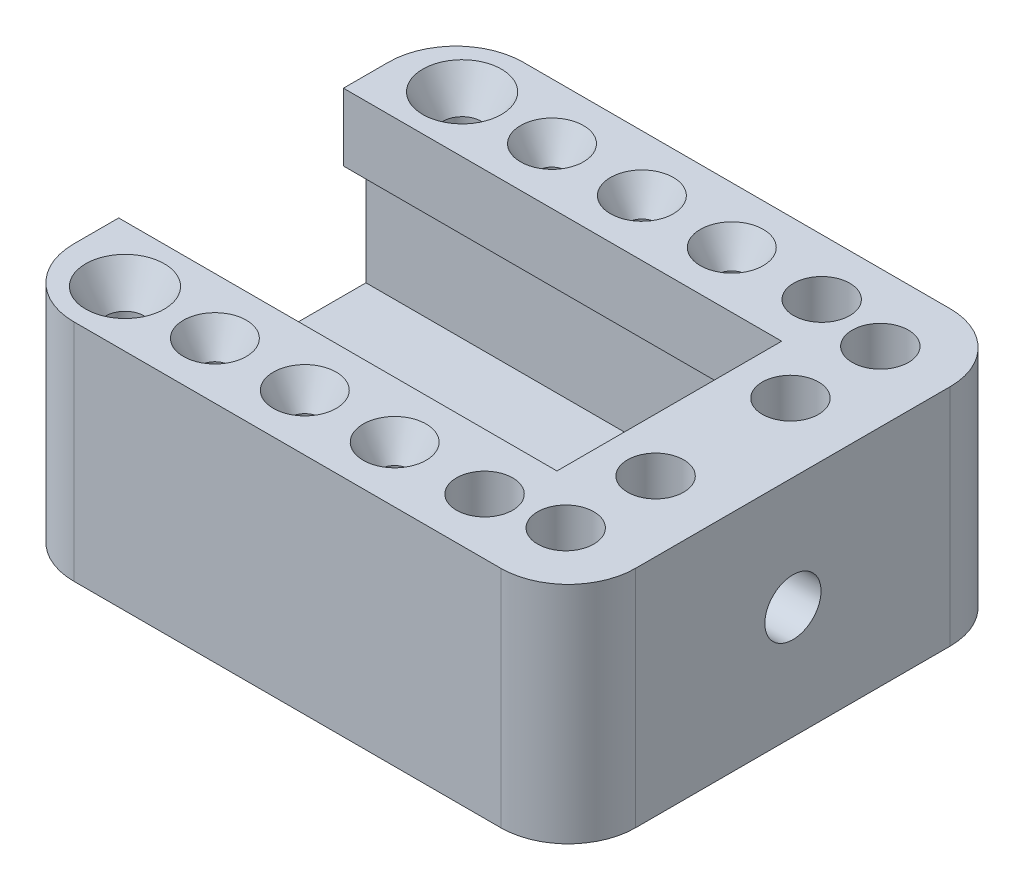
from build123d import *

# Parameters (mm, degrees)
SKETCH1_W                                         = 63.5
SKETCH1_H                                         = 50.8
BOSS_EXTRUDE1_DEPTH                               = 25.4
FILLET1_R                                         = 7.62
CUT_EXTRUDE1_DEPTH                                = 50.8
SKETCH4_W                                         = 49.53
SKETCH4_H                                         = 25.4
CUT_EXTRUDE2_DEPTH                                = 13.462
CSK_FOR_2_FLAT_HEAD_MACHINE_SCREW_100_D           = 4.318
CSK_FOR_2_FLAT_HEAD_MACHINE_SCREW_100_CSINK_D     = 8.89
CSK_FOR_2_FLAT_HEAD_MACHINE_SCREW_100_CSINK_ANGLE = 60
CSK_FOR_2_FLAT_HEAD_MACHINE_SCREW_2_D             = 3.175
CSK_FOR_2_FLAT_HEAD_MACHINE_SCREW_2_CSINK_D       = 7.112
CSK_FOR_2_FLAT_HEAD_MACHINE_SCREW_2_CSINK_ANGLE   = 60
SKETCH9_R                                         = 3.175
CUT_EXTRUDE3_DEPTH                                = 12.7
F_1_4_0_25_DIAMETER_HOLE1_D                       = 6.35
F_1_4_0_25_DIAMETER_HOLE2_D                       = 6.35
CUT_EXTRUDE4_DEPTH                                = 2.54
SKETCH15_W                                        = 3.09588561
SKETCH15_H                                        = 7.430125466
SKETCH15_W_2                                      = 7.430125466
SKETCH15_H_2                                      = 7.430125465
SKETCH15_W_3                                      = 2.91808561
SKETCH15_H_3                                      = 7.607925465
CUT_EXTRUDE5_DEPTH                                = 2.54
SKETCH16_R                                        = 3.175
CUT_EXTRUDE8_DEPTH                                = 6.985
SKETCH17_R                                        = 3.81
CUT_EXTRUDE9_DEPTH                                = 6.985


with BuildPart() as part:
    # Sketch1 → Boss-Extrude1 (new body)
    with BuildSketch(Plane(origin=(0, 0, 0), x_dir=(1, 0, 0), z_dir=(0, 1, 0))):
        with Locations((31.75, 25.4)):
            Rectangle(SKETCH1_W, SKETCH1_H)
    extrude(amount=BOSS_EXTRUDE1_DEPTH)

    # Fillet1
    fillet1_edges = [part.edges().sort_by_distance(p)[0] for p in [
        (0, 12.7, -50.8),
        (63.5, 12.7, -50.8),
        (63.5, 12.7, 0),
        (0, 12.7, 0),
    ]]
    fillet(fillet1_edges, radius=FILLET1_R)

    # Sketch2 → Cut-Extrude1 (cut)
    with BuildSketch(Plane.ZY):
        Polygon((-38.1, 24.003), (-12.7, 24.003), (-12.7, 17.78), (-10.16, 17.78), (-10.16, 5.08), (-40.64, 5.08), (-40.64, 17.78), (-38.1, 17.78), align=None)
    extrude(amount=-CUT_EXTRUDE1_DEPTH, mode=Mode.SUBTRACT)

    # Sketch4 → Cut-Extrude2 (cut)
    with BuildSketch(Plane(origin=(0, 25.4, 0), x_dir=(1, 0, 0), z_dir=(0, 1, 0))):
        with Locations((24.765, 25.4)):
            Rectangle(SKETCH4_W, SKETCH4_H)
    extrude(amount=-CUT_EXTRUDE2_DEPTH, mode=Mode.SUBTRACT)

    # CSK for _2 Flat Head Machine Screw _100 (through all)
    with Locations(Plane(origin=(0, 25.4, 0), x_dir=(1, 0, 0), z_dir=(0, 1, 0))):
        with Locations((7.0612, 44.45)):
            csk_for_2_flat_head_machine_screw_100 = CounterSinkHole(CSK_FOR_2_FLAT_HEAD_MACHINE_SCREW_100_D / 2, CSK_FOR_2_FLAT_HEAD_MACHINE_SCREW_100_CSINK_D / 2, counter_sink_angle=CSK_FOR_2_FLAT_HEAD_MACHINE_SCREW_100_CSINK_ANGLE)

    # CSK for _2 Flat Head Machine Screw _ 2 (through all)
    with Locations(Plane(origin=(0, 25.4, 0), x_dir=(1, 0, 0), z_dir=(0, 1, 0))):
        with Locations((17.2212, 44.45), (27.3812, 44.45), (37.5412, 44.45)):
            csk_for_2_flat_head_machine_screw_2 = CounterSinkHole(CSK_FOR_2_FLAT_HEAD_MACHINE_SCREW_2_D / 2, CSK_FOR_2_FLAT_HEAD_MACHINE_SCREW_2_CSINK_D / 2, counter_sink_angle=CSK_FOR_2_FLAT_HEAD_MACHINE_SCREW_2_CSINK_ANGLE)

    # Sketch9 → Cut-Extrude3 (cut)
    with BuildSketch(Plane(origin=(0, 25.4, 0), x_dir=(1, 0, 0), z_dir=(0, 1, 0))):
        with Locations(Location((47.7012, 44.45, 0), (0, 0, 270))):
            Circle(SKETCH9_R)
    cut_extrude3 = extrude(amount=-CUT_EXTRUDE3_DEPTH, mode=Mode.SUBTRACT)

    # 1/4 (0.25) Diameter Hole1 (through all)
    with Locations(Plane(origin=(0, 25.4, 0), x_dir=(1, 0, 0), z_dir=(0, 1, 0))):
        with Locations((55.6006, 43.18)):
            f_1_4_0_25_diameter_hole1 = Hole(F_1_4_0_25_DIAMETER_HOLE1_D / 2)

    # Mirror1: CSK for _2 Flat Head Machine Screw _100, CSK for _2 Flat Head Machine Screw _ 2, Cut-Extrude3, 1/4 (0.25) Diameter Hole1 across plane
    add(csk_for_2_flat_head_machine_screw_100.mirror(Plane.XY.offset(-25.4)), mode=Mode.SUBTRACT)
    add(csk_for_2_flat_head_machine_screw_2.mirror(Plane.XY.offset(-25.4)), mode=Mode.SUBTRACT)
    add(cut_extrude3.mirror(Plane.XY.offset(-25.4)), mode=Mode.SUBTRACT)
    add(f_1_4_0_25_diameter_hole1.mirror(Plane.XY.offset(-25.4)), mode=Mode.SUBTRACT)

    # 1/4 (0.25) Diameter Hole2 (through all)
    with Locations(Plane(origin=(0, 25.4, 0), x_dir=(1, 0, 0), z_dir=(0, 1, 0))):
        with Locations((55.6006, 33.02), (55.6006, 17.78)):
            Hole(F_1_4_0_25_DIAMETER_HOLE2_D / 2)

    # Sketch14 → Cut-Extrude4 (cut)
    with BuildSketch(Plane.XZ):
        Polygon((9.997746715, -8.735687211), (10.595539088, -4.999719551), (7.658992373, -2.61403234), (4.124653285, -3.964312789), (3.526860912, -7.700280449), (6.463407627, -10.08596766), align=None)
        Polygon((7.658992373, -40.71403234), (4.124653285, -42.064312789), (3.526860912, -45.800280449), (6.463407627, -48.18596766), (9.997746715, -46.835687211), (10.595539088, -43.099719551), align=None)
    extrude(amount=-CUT_EXTRUDE4_DEPTH, mode=Mode.SUBTRACT)

    # Sketch15 → Cut-Extrude5 (cut)
    with BuildSketch(Plane.XZ):
        with Locations((42.72716817, -25.4)):
            Rectangle(SKETCH15_W, SKETCH15_H)
        with Locations((35.508362632, -25.4)):
            Rectangle(SKETCH15_W_2, SKETCH15_H)
        with Locations((26.110362632, -25.4)):
            Rectangle(SKETCH15_W_2, SKETCH15_H)
        with Locations((16.712362632, -25.4)):
            Rectangle(SKETCH15_W_2, SKETCH15_H)
        with Locations((42.72716817, -15.840689934)):
            Rectangle(SKETCH15_W, SKETCH15_H)
        with Locations((16.712362632, -16.014074535)):
            Rectangle(SKETCH15_W_2, SKETCH15_H_2)
        with Locations((35.508362632, -15.840689934)):
            Rectangle(SKETCH15_W_2, SKETCH15_H)
        with Locations((26.110362632, -15.840689934)):
            Rectangle(SKETCH15_W_2, SKETCH15_H)
        with Locations((35.508362632, -34.785925466)):
            Rectangle(SKETCH15_W_2, SKETCH15_H_2)
        with Locations((42.63826817, -34.874825466)):
            Rectangle(SKETCH15_W_3, SKETCH15_H_3)
        with Locations((26.110362632, -34.874825466)):
            Rectangle(SKETCH15_W_2, SKETCH15_H_3)
        with Locations((16.712362632, -34.785925466)):
            Rectangle(SKETCH15_W_2, SKETCH15_H_2)
    extrude(amount=-CUT_EXTRUDE5_DEPTH, mode=Mode.SUBTRACT)

    # Sketch16 → Cut-Extrude8 (cut)
    with BuildSketch(Plane(origin=(63.5, 0, 0), x_dir=(0, 0, -1), z_dir=(1, 0, 0))):
        with Locations((25.4, 12.7)):
            Circle(SKETCH16_R)
    extrude(amount=-CUT_EXTRUDE8_DEPTH, mode=Mode.SUBTRACT)

    # Sketch17 → Cut-Extrude9 (cut)
    with BuildSketch(Plane.ZY.offset(-50.8)):
        with Locations((-25.4, 12.7)):
            Circle(SKETCH17_R)
    extrude(amount=-CUT_EXTRUDE9_DEPTH, mode=Mode.SUBTRACT)


solid = part.part
